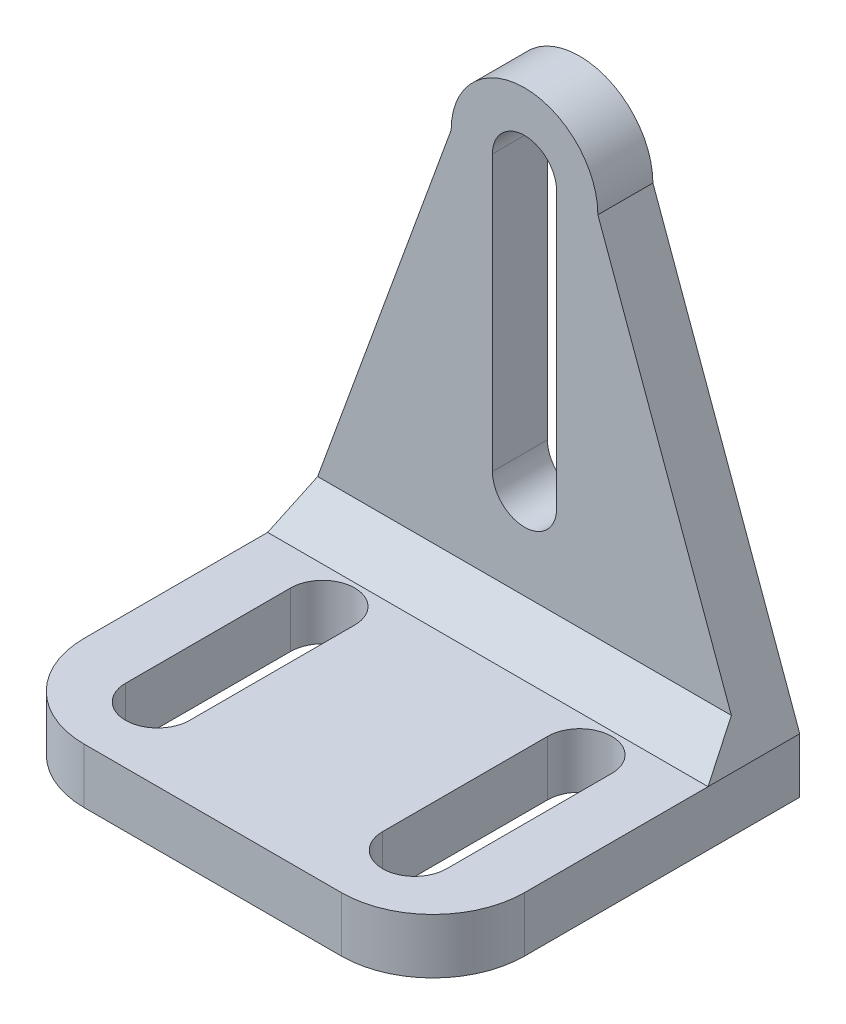
from build123d import *

# Parameters (mm, degrees)
EXTRUDE_1_DEPTH     = 3
SKETCH_1_3_W        = 24.014690308
SKETCH_1_3_H        = 3
EXTRUDE_2_DEPTH     = 20
CUT_EXTRUDE_1_DEPTH = 15
FILLET_1_R          = 5
CHAMFER_1_SIZE      = 2


with BuildPart() as part:
    # 草图1 → 凸台-拉伸1 (new body)
    with BuildSketch(Plane.XY):
        with BuildLine():
            Line((12.007345154, -22), (4, 0))
            ThreePointArc((4, 0), (0, 4), (-4, 0))
            Line((-4, 0), (-12.007345154, -22))
            Line((-12.007345154, -22), (12.007345154, -22))
        make_face()
        with BuildLine():
            Line((-1.75, -15), (-1.75, 0))
            ThreePointArc((-1.75, 0), (0, 1.75), (1.75, 0))
            Line((1.75, 0), (1.75, -15))
            ThreePointArc((1.75, -15), (0, -16.75), (-1.75, -15))
        make_face(mode=Mode.SUBTRACT)
    extrude(amount=EXTRUDE_1_DEPTH)

    # 草图1<3> → 凸台-拉伸2 (add)
    with BuildSketch(Plane.XY):
        with Locations((0, -23.5)):
            Rectangle(SKETCH_1_3_W, SKETCH_1_3_H)
    extrude(amount=EXTRUDE_2_DEPTH)

    # 草图2 → 切除-拉伸1 (cut)
    with BuildSketch(Plane(origin=(0, -22, 0), x_dir=(1, 0, 0), z_dir=(0, 1, 0))):
        with BuildLine():
            ThreePointArc((-5.257345154, -7), (-7.007345154, -5.25), (-8.757345154, -7))
            Line((-8.757345154, -7), (-8.757345154, -16))
            ThreePointArc((-8.757345154, -16), (-7.007345154, -17.75), (-5.257345154, -16))
            Line((-5.257345154, -16), (-5.257345154, -7))
        make_face()
        with BuildLine():
            Line((8.757345154, -16), (8.757345154, -7))
            ThreePointArc((8.757345154, -7), (7.007345154, -5.25), (5.257345154, -7))
            Line((5.257345154, -7), (5.257345154, -16))
            ThreePointArc((5.257345154, -16), (7.007345154, -17.75), (8.757345154, -16))
        make_face()
    extrude(amount=-CUT_EXTRUDE_1_DEPTH, mode=Mode.SUBTRACT)

    # 圆角1
    fillet_1_edges = [part.edges().sort_by_distance(p)[0] for p in [
        (-12.007345154, -23.5, 20),
        (12.007345154, -23.5, 20),
    ]]
    fillet(fillet_1_edges, radius=FILLET_1_R)

    # 倒角1
    chamfer_1_edges = [part.edges().sort_by_distance(p)[0] for p in [
        (0, -22, 3),
    ]]
    chamfer(chamfer_1_edges, length=CHAMFER_1_SIZE)


solid = part.part
